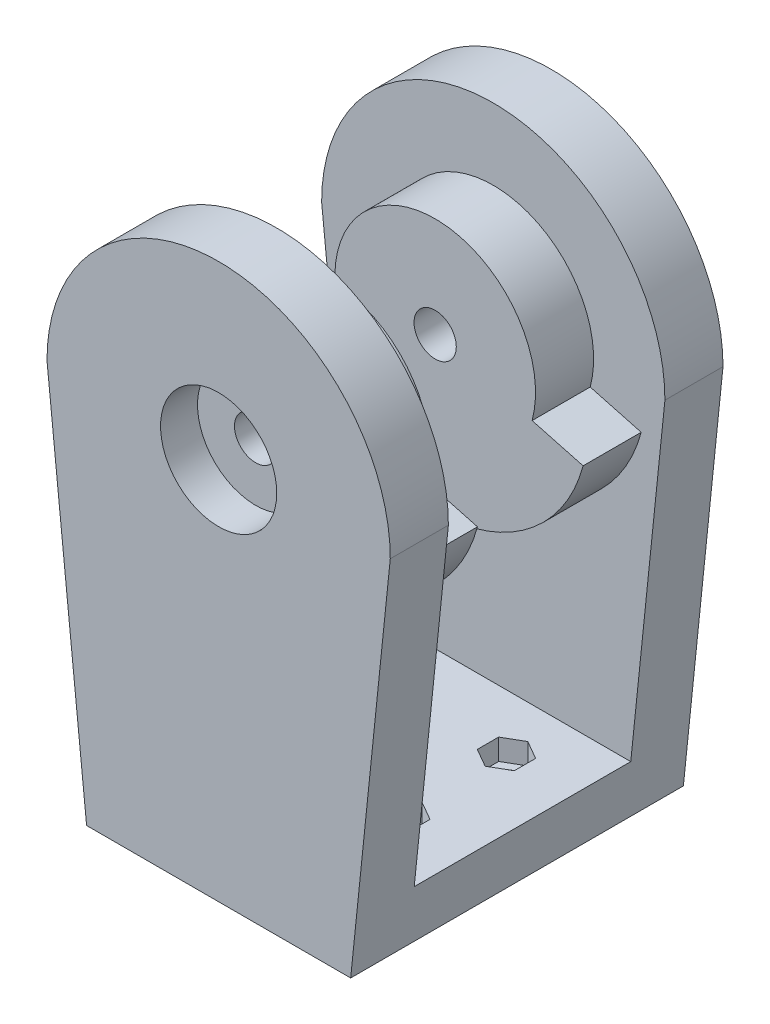
from build123d import *

# Parameters (mm, degrees)
SALIENTE_EXTRUIR1_DEPTH = 11
CROQUIS2_R              = 11
CORTAR_EXTRUIR1_DEPTH   = 7
CROQUIS3_R              = 19
SALIENTE_EXTRUIR2_DEPTH = 10
CROQUIS4_R              = 4
CORTAR_EXTRUIR2_DEPTH   = 18
SALIENTE_EXTRUIR3_DEPTH = 52
SALIENTE_EXTRUIR4_DEPTH = 11
CORTAR_EXTRUIR3_START   = -22
CROQUIS7_R              = 4
CORTAR_EXTRUIR3_DEPTH   = 22
SALIENTE_EXTRUIR5_START = 11
CROQUIS8_R              = 19
SALIENTE_EXTRUIR5_DEPTH = 11
CROQUIS10_R             = 4
CORTAR_EXTRUIR5_DEPTH   = 102.39773173
CORTAR_EXTRUIR6_START   = -7
CROQUIS11_R             = 11
CORTAR_EXTRUIR6_DEPTH   = 7
SALIENTE_EXTRUIR6_DEPTH = 10
SALIENTE_EXTRUIR7_START = 11
SALIENTE_EXTRUIR7_DEPTH = 11
CROQUIS14_R             = 2
CORTAR_EXTRUIR7_DEPTH   = 11
CORTAR_EXTRUIR8_DEPTH   = 4


with BuildPart() as part:
    # Croquis1 → Saliente-Extruir1 (new body)
    with BuildSketch(Plane.XY):
        with BuildLine():
            Line((-32.5, 0), (-25, -72.5))
            Line((-25, -72.5), (25, -72.5))
            Line((25, -72.5), (32.5, 0))
            ThreePointArc((32.5, 0), (0, 32.5), (-32.5, 0))
        make_face()
    extrude(amount=SALIENTE_EXTRUIR1_DEPTH)

    # Croquis2 → Cortar-Extruir1 (cut)
    with BuildSketch(Plane.XY.offset(11)):
        Circle(CROQUIS2_R)
    extrude(amount=-CORTAR_EXTRUIR1_DEPTH, mode=Mode.SUBTRACT)

    # Croquis3 → Saliente-Extruir2 (add)
    with BuildSketch(Plane(origin=(0, 0, 0), x_dir=(-1, 0, 0), z_dir=(0, 0, -1))):
        with Locations(Location((0, 0, 0), (0, 0, 180))):
            Circle(CROQUIS3_R)
    extrude(amount=SALIENTE_EXTRUIR2_DEPTH)

    # Croquis4 → Cortar-Extruir2 (cut)
    with BuildSketch(Plane.XY.offset(4)):
        Circle(CROQUIS4_R)
    extrude(amount=-CORTAR_EXTRUIR2_DEPTH, mode=Mode.SUBTRACT)

    # Croquis5 → Saliente-Extruir3 (add)
    with BuildSketch(Plane(origin=(0, 0, 0), x_dir=(-1, 0, 0), z_dir=(0, 0, -1))):
        Polygon((-25, -72.5), (25, -72.5), (26.034482759, -62.5), (-26.034482759, -62.5), align=None)
    extrude(amount=SALIENTE_EXTRUIR3_DEPTH)

    # Croquis6 → Saliente-Extruir4 (add)
    with BuildSketch(Plane(origin=(0, 0, -52), x_dir=(-1, 0, 0), z_dir=(0, 0, -1))):
        with BuildLine():
            Line((25, -72.5), (32.5, 0))
            ThreePointArc((32.5, 0), (0, 32.5), (-32.5, 0))
            Line((-32.5, 0), (-25, -72.5))
            Line((-25, -72.5), (25, -72.5))
        make_face()
    extrude(amount=-SALIENTE_EXTRUIR4_DEPTH)

    # Croquis7 → Cortar-Extruir3 (cut)
    with BuildSketch(Plane(origin=(0, 0, -52), x_dir=(-1, 0, 0), z_dir=(0, 0, -1)).offset(CORTAR_EXTRUIR3_START)):
        with Locations(Location((0, 0, 0), (0, 0, 180))):
            Circle(CROQUIS7_R)
    extrude(amount=CORTAR_EXTRUIR3_DEPTH, mode=Mode.SUBTRACT)

    # Croquis8 → Saliente-Extruir5 (add)
    with BuildSketch(Plane.XY.offset(-41).offset(SALIENTE_EXTRUIR5_START)):
        Circle(CROQUIS8_R)
    extrude(amount=-SALIENTE_EXTRUIR5_DEPTH)

    # Croquis10 → Cortar-Extruir5 (cut, through all)
    with BuildSketch(Plane(origin=(0, 0, -52), x_dir=(-1, 0, 0), z_dir=(0, 0, -1))):
        with Locations(Location((0, 0, 0), (0, 0, 180))):
            Circle(CROQUIS10_R)
    extrude(amount=-CORTAR_EXTRUIR5_DEPTH, mode=Mode.SUBTRACT)

    # Croquis11 → Cortar-Extruir6 (cut)
    with BuildSketch(Plane(origin=(0, 0, -52), x_dir=(-1, 0, 0), z_dir=(0, 0, -1)).offset(CORTAR_EXTRUIR6_START)):
        with Locations(Location((0, 0, 0), (0, 0, 180))):
            Circle(CROQUIS11_R)
    extrude(amount=CORTAR_EXTRUIR6_DEPTH, mode=Mode.SUBTRACT)

    # Croquis12 → Saliente-Extruir6 (add)
    with BuildSketch(Plane(origin=(0, 0, 0), x_dir=(-1, 0, 0), z_dir=(0, 0, -1))):
        with BuildLine():
            Line((-18.352590699, -4.917561857), (-28.011848962, -7.505752308))
            ThreePointArc((-28.011848962, -7.505752308), (-5.035797152, -28.559424837), (23.755409284, -16.633716654))
            Line((23.755409284, -16.633716654), (15.563888841, -10.897952291))
            ThreePointArc((15.563888841, -10.897952291), (-3.299315376, -18.711347307), (-18.352590699, -4.917561857))
        make_face()
    extrude(amount=SALIENTE_EXTRUIR6_DEPTH)

    # Croquis13 → Saliente-Extruir7 (add)
    with BuildSketch(Plane.XY.offset(-41).offset(SALIENTE_EXTRUIR7_START)):
        with BuildLine():
            Line((-15.563888841, -10.897952291), (-23.755409284, -16.633716654))
            ThreePointArc((-23.755409284, -16.633716654), (5.035797152, -28.559424837), (28.011848962, -7.505752308))
            Line((28.011848962, -7.505752308), (18.352590699, -4.917561857))
            ThreePointArc((18.352590699, -4.917561857), (3.299315376, -18.711347307), (-15.563888841, -10.897952291))
        make_face()
    extrude(amount=-SALIENTE_EXTRUIR7_DEPTH)

    # Croquis14 → Cortar-Extruir7 (cut)
    with BuildSketch(Plane(origin=(0, -62.5, 0), x_dir=(1, 0, 0), z_dir=(0, 1, 0))):
        with Locations(Location((-13, 30.5, 0), (0, 0, 270))):
            Circle(CROQUIS14_R)
        with Locations(Location((13, 30.5, 0), (0, 0, 270))):
            Circle(CROQUIS14_R)
        with Locations(Location((13, 10.5, 0), (0, 0, 270))):
            Circle(CROQUIS14_R)
        with Locations(Location((-13, 10.5, 0), (0, 0, 270))):
            Circle(CROQUIS14_R)
    extrude(amount=-CORTAR_EXTRUIR7_DEPTH, mode=Mode.SUBTRACT)

    # Croquis15 → Cortar-Extruir8 (cut)
    with BuildSketch(Plane(origin=(0, -62.5, 0), x_dir=(1, 0, 0), z_dir=(0, 1, 0))):
        Polygon((13, 26.458548116), (9.5, 28.479274058), (9.5, 32.520725942), (13, 34.541451884), (16.5, 32.520725942), (16.5, 28.479274058), align=None)
        Polygon((-9.5, 28.479274058), (-9.5, 32.520725942), (-13, 34.541451884), (-16.5, 32.520725942), (-16.5, 28.479274058), (-13, 26.458548116), align=None)
        Polygon((16.5, 12.520725942), (13, 14.541451884), (9.5, 12.520725942), (9.5, 8.479274058), (13, 6.458548116), (16.5, 8.479274058), align=None)
        Polygon((-13, 14.541451884), (-9.5, 12.520725942), (-9.5, 8.479274058), (-13, 6.458548116), (-16.5, 8.479274058), (-16.5, 12.520725942), align=None)
    extrude(amount=-CORTAR_EXTRUIR8_DEPTH, mode=Mode.SUBTRACT)


solid = part.part
